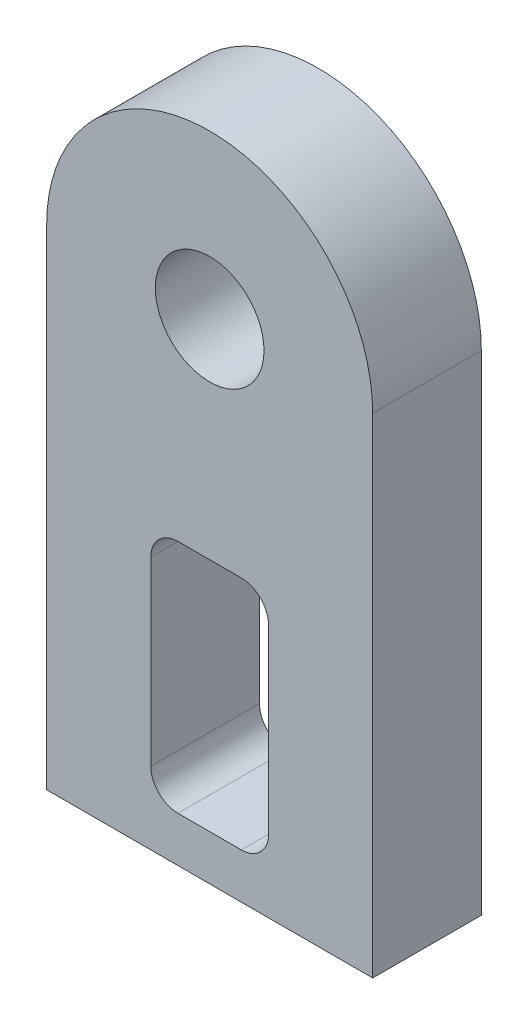
from build123d import *

# Parameters (mm, degrees)
MODEL_R                 = 1.5
SALIENTE_EXTRUIR1_DEPTH = 3


with BuildPart() as part:
    # Model → Saliente-Extruir1 (new body)
    with BuildSketch(Plane.XY):
        with BuildLine():
            Line((159.591356547, 212.494036843), (159.591356547, 198.994036843))
            Line((159.591356547, 198.994036843), (150.591356547, 198.994036843))
            Line((150.591356547, 198.994036843), (150.591356547, 212.494036843))
            ThreePointArc((150.591356547, 212.494036843), (155.091356547, 216.994036843), (159.591356547, 212.494036843))
        make_face()
        with Locations((155.091356547, 212.494036843)):
            Circle(MODEL_R, mode=Mode.SUBTRACT)
        with BuildLine():
            Line((153.466356547, 200.994036843), (153.466356547, 205.994036843))
            ThreePointArc((153.466356547, 205.994036843), (153.686026462, 206.524366929), (154.216356547, 206.744036843))
            Line((154.216356547, 206.744036843), (155.966356547, 206.744036843))
            ThreePointArc((155.966356547, 206.744036843), (156.496686633, 206.524366929), (156.716356547, 205.994036843))
            Line((156.716356547, 205.994036843), (156.716356547, 200.994036843))
            ThreePointArc((156.716356547, 200.994036843), (156.496686633, 200.463706757), (155.966356547, 200.244036843))
            Line((155.966356547, 200.244036843), (154.216356547, 200.244036843))
            ThreePointArc((154.216356547, 200.244036843), (153.686026462, 200.463706757), (153.466356547, 200.994036843))
        make_face(mode=Mode.SUBTRACT)
    extrude(amount=SALIENTE_EXTRUIR1_DEPTH)


solid = part.part
